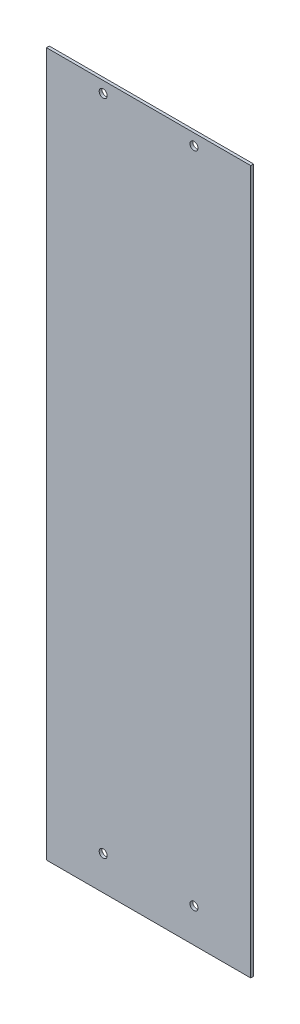
from build123d import *

# Parameters (mm, degrees)
SKETCH1_W           = 114.3
SKETCH1_H           = 393.7
SKETCH1_R           = 2.25
BOSS_EXTRUDE1_DEPTH = 1.5875


with BuildPart() as part:
    # Sketch1 → Boss-Extrude1 (new body)
    with BuildSketch(Plane.XY):
        with Locations((57.15, 196.85)):
            Rectangle(SKETCH1_W, SKETCH1_H)
        with Locations((31.75, 387.35)):
            Circle(SKETCH1_R, mode=Mode.SUBTRACT)
        with Locations((82.55, 387.35)):
            Circle(SKETCH1_R, mode=Mode.SUBTRACT)
        with Locations((31.75, 19.05)):
            Circle(SKETCH1_R, mode=Mode.SUBTRACT)
        with Locations((82.55, 19.05)):
            Circle(SKETCH1_R, mode=Mode.SUBTRACT)
    extrude(amount=BOSS_EXTRUDE1_DEPTH)


solid = part.part
